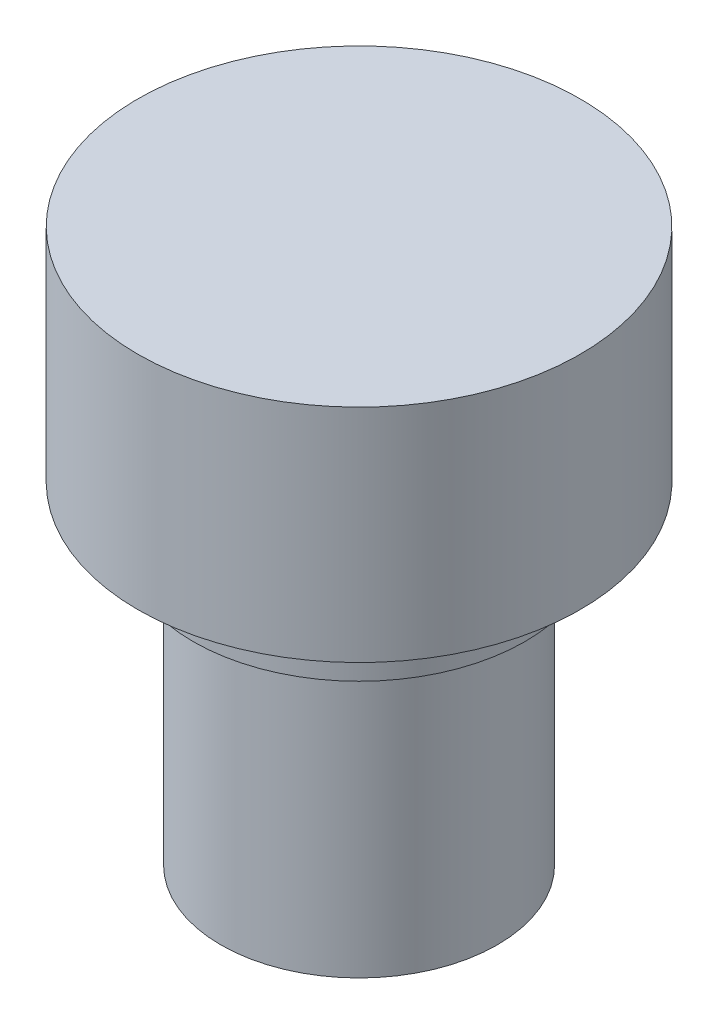
from build123d import *

# Parameters (mm, degrees)
ESBO_O1_R                = 4
RESSALTO_EXTRUS_O1_DEPTH = 4
ESBO_O4_R                = 2.5
RESSALTO_EXTRUS_O2_DEPTH = 6
ESBO_O5_R                = 3
RESSALTO_EXTRUS_O4_DEPTH = 1


with BuildPart() as part:
    # Esboço1 → Ressalto-extrusão1 (new body)
    with BuildSketch(Plane(origin=(0, 0, 0), x_dir=(1, 0, 0), z_dir=(0, 1, 0))):
        with Locations(Location((0, 0, 0), (0, 0, 270))):
            Circle(ESBO_O1_R)
    extrude(amount=RESSALTO_EXTRUS_O1_DEPTH)

    # Esboço4 → Ressalto-extrusão2 (add)
    with BuildSketch(Plane(origin=(0, 0, 0), x_dir=(-1, 0, 0), z_dir=(0, -1, 0))):
        with Locations(Location((0, 0, 0), (0, 0, 90))):
            Circle(ESBO_O4_R)
    extrude(amount=RESSALTO_EXTRUS_O2_DEPTH)

    # Esboço5 → Ressalto-extrusão4 (add)
    with BuildSketch(Plane.XZ):
        with Locations(Location((0, 0, 0), (0, 0, 90))):
            Circle(ESBO_O5_R)
    extrude(amount=RESSALTO_EXTRUS_O4_DEPTH)

    # Esboço7 → Broca de rosquear para tarraxa de M31 (revolve, cut)
    with BuildSketch(Plane(origin=(0, -6, 0), x_dir=(0, 0, -1), z_dir=(1, 0, 0))):
        Polygon((0, 0), (0, 8.751075774), (1.25, 8), (1.25, 0), align=None)
    revolve(axis=Axis((0, -12.35, 0), (0, 1, 0)), mode=Mode.SUBTRACT)


solid = part.part
